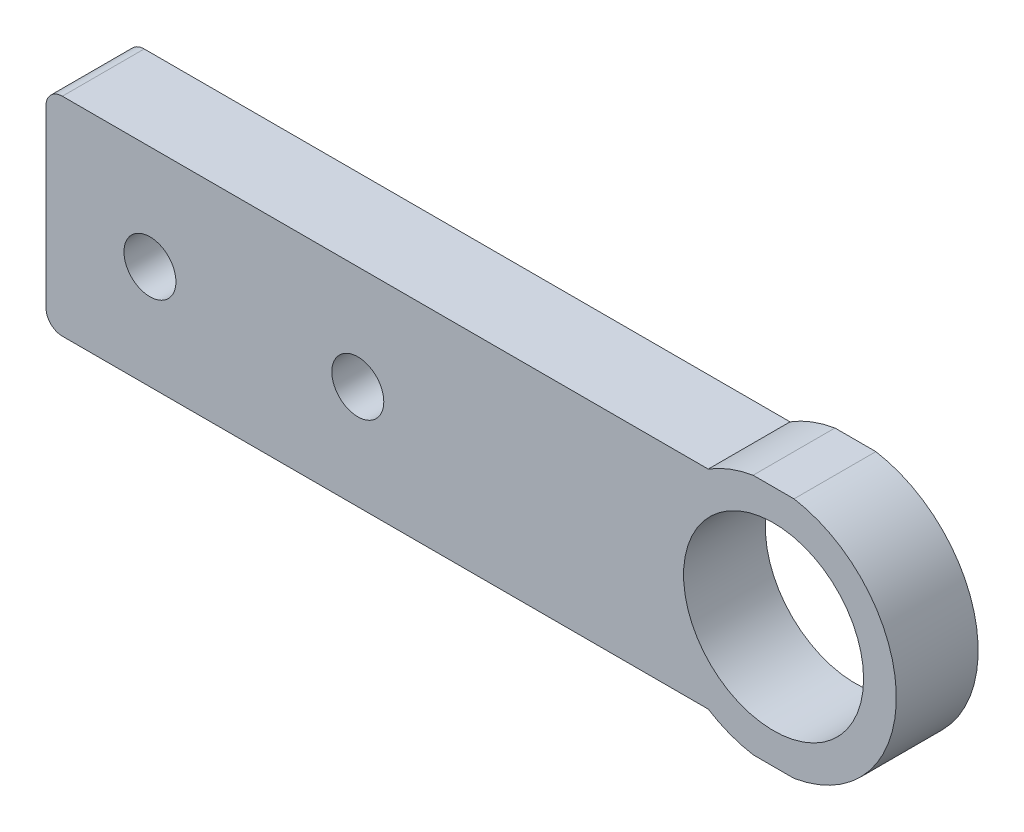
from build123d import *

# Parameters (mm, degrees)
SKETCH1_R           = 3.175
SKETCH1_R_2         = 11
BOSS_EXTRUDE1_DEPTH = 10
FILLET3_R           = 2


with BuildPart() as part:
    # Sketch1 → Boss-Extrude1 (new body)
    with BuildSketch(Plane.XY):
        with BuildLine():
            Line((-44.45, -12.7), (-44.45, 12.7))
            Line((-44.45, 12.7), (36.468145579, 12.7))
            ThreePointArc((36.468145579, 12.7), (39.105886278, 14.015721477), (41.95, 14.790199458))
            Line((41.95, 14.790199458), (46.95, 14.790199458))
            ThreePointArc((46.95, 14.790199458), (59.45, 0), (46.95, -14.790199458))
            Line((46.95, -14.790199458), (41.95, -14.790199458))
            ThreePointArc((41.95, -14.790199458), (39.105886278, -14.015721477), (36.468145579, -12.7))
            Line((36.468145579, -12.7), (-44.45, -12.7))
        make_face()
        with Locations((-31.75, 0)):
            Circle(SKETCH1_R, mode=Mode.SUBTRACT)
        with Locations((44.45, 0)):
            Circle(SKETCH1_R_2, mode=Mode.SUBTRACT)
        with Locations((-6.35, 0)):
            Circle(SKETCH1_R, mode=Mode.SUBTRACT)
    extrude(amount=BOSS_EXTRUDE1_DEPTH)

    # Fillet3
    fillet3_edges = [part.edges().sort_by_distance(p)[0] for p in [
        (-44.45, -12.7, 5),
        (-44.45, 12.7, 5),
    ]]
    fillet(fillet3_edges, radius=FILLET3_R)


solid = part.part
